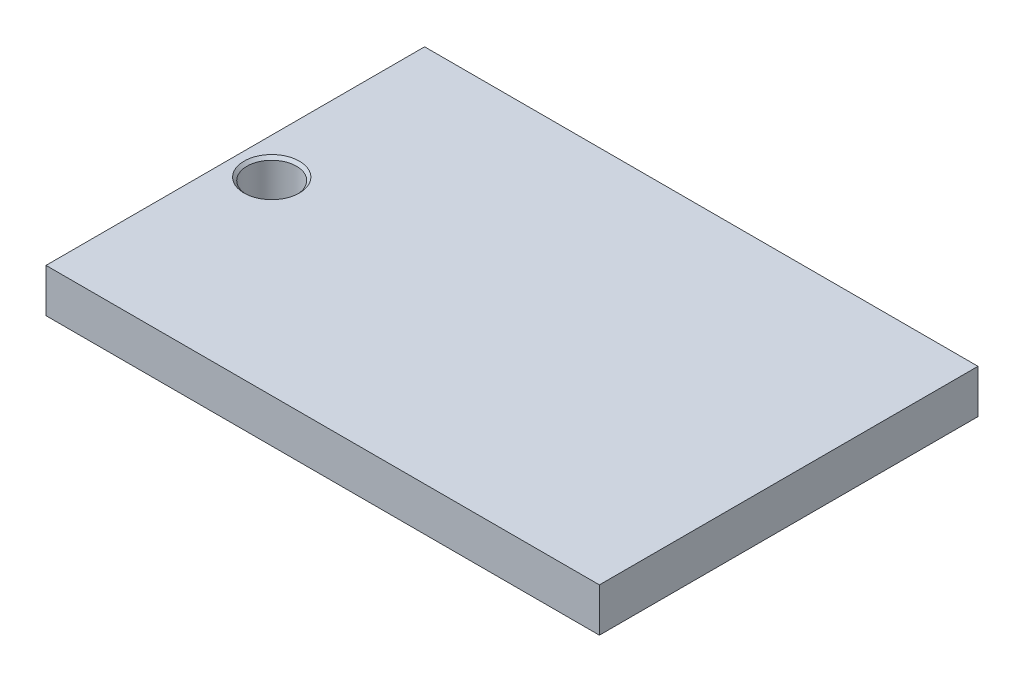
from build123d import *

# Parameters (mm, degrees)
SKETCH1_W           = 48.24984
SKETCH1_H           = 33.00984
BOSS_EXTRUDE1_DEPTH = 3.80111
CUT_EXTRUDE1_REACH  = 31.477
SKETCH2_R           = 2.159
CHAMFER1_SIZE       = 0.254


with BuildPart() as part:
    # Sketch1 → Boss-Extrude1 (new body)
    with BuildSketch(Plane(origin=(0, 0, 0), x_dir=(1, 0, 0), z_dir=(0, 1, 0))):
        Rectangle(SKETCH1_W, SKETCH1_H)
    extrude(amount=BOSS_EXTRUDE1_DEPTH)

    # Sketch2 → Cut-Extrude1 (cut, up to next)
    with BuildSketch(Plane(origin=(0, 3.80111, 0), x_dir=(1, 0, 0), z_dir=(0, 1, 0)), mode=Mode.PRIVATE) as cut_extrude1_sk1:
        with Locations(Location((-20.94992, 0, 0), (0, 0, 270))):
            Circle(SKETCH2_R)
    cut_extrude1_tool1 = extrude(cut_extrude1_sk1.sketch, amount=-CUT_EXTRUDE1_REACH, mode=Mode.PRIVATE) & part.part
    add(cut_extrude1_tool1.solids().sort_by_distance((-20.94992, 3.80111, 0))[0], mode=Mode.SUBTRACT)

    # Chamfer1
    chamfer1_edges = [part.edges().sort_by_distance(p)[0] for p in [
        (-20.94992, 0, -2.159),
        (-20.94992, 3.80111, -2.159),
    ]]
    chamfer(chamfer1_edges, length=CHAMFER1_SIZE)


solid = part.part
